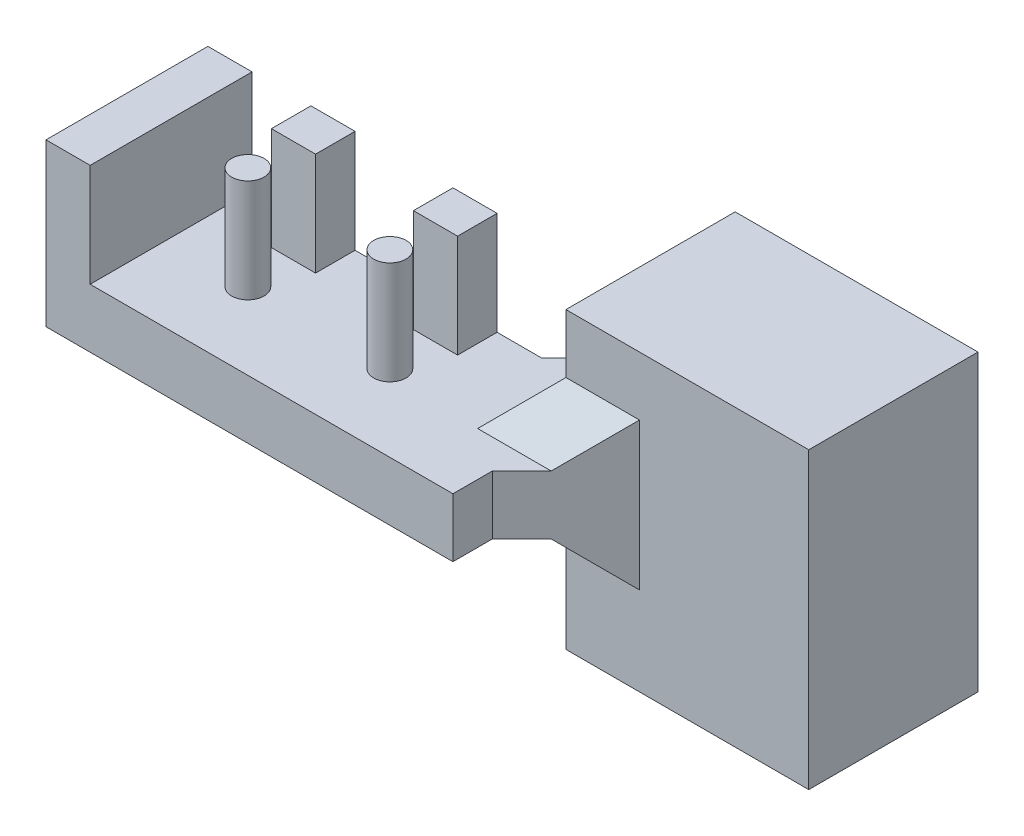
from build123d import *

# Parameters (mm, degrees)
SKETCH1_W           = 16.5
SKETCH1_H           = 11.5
SKETCH1_W_2         = 10.5
SKETCH1_H_2         = 5.5
BOSS_EXTRUDE1_DEPTH = 17
CUT_EXTRUDE1_REACH  = 28.334
SKETCH2_R           = 2.5
SKETCH3_W           = 16.5
SKETCH3_H           = 11.5
BOSS_EXTRUDE2_DEPTH = 3
BOSS_EXTRUDE3_START = -11
SKETCH4_W           = 21.75
SKETCH4_H           = 11
BOSS_EXTRUDE3_DEPTH = 4
CHAMFER1_SIZE       = 5
CHAMFER2_SIZE       = 3
SKETCH5_R           = 1.1
SKETCH5_W           = 3
SKETCH5_H           = 2.684
BOSS_EXTRUDE4_DEPTH = 7
BOSS_EXTRUDE5_DEPTH = 11
CUT_EXTRUDE2_REACH  = 41.144
SKETCH7_W           = 10.5
SKETCH7_H           = 1.5


with BuildPart() as part:
    # Sketch1 → Boss-Extrude1 (new body)
    with BuildSketch(Plane(origin=(0, 0, 0), x_dir=(1, 0, 0), z_dir=(0, 1, 0))):
        with Locations((8.25, 5.75)):
            Rectangle(SKETCH1_W, SKETCH1_H)
        with Locations((8.25, 5.75)):
            Rectangle(SKETCH1_W_2, SKETCH1_H_2, mode=Mode.SUBTRACT)
    extrude(amount=BOSS_EXTRUDE1_DEPTH)

    # Sketch2 → Cut-Extrude1 (cut, up to next)
    with BuildSketch(Plane(origin=(0, 0, -11.5), x_dir=(-1, 0, 0), z_dir=(0, 0, -1)), mode=Mode.PRIVATE) as cut_extrude1_sk1:
        with Locations((-8.25, 10.5)):
            Circle(SKETCH2_R)
    cut_extrude1_tool1 = extrude(cut_extrude1_sk1.sketch, amount=-CUT_EXTRUDE1_REACH, mode=Mode.PRIVATE) & part.part
    add(cut_extrude1_tool1.solids().sort_by_distance((8.25, 10.5, -11.5))[0], mode=Mode.SUBTRACT)

    # Sketch3 → Boss-Extrude2 (add)
    with BuildSketch(Plane(origin=(0, 17, 0), x_dir=(1, 0, 0), z_dir=(0, 1, 0))):
        with Locations((8.25, 5.75)):
            Rectangle(SKETCH3_W, SKETCH3_H)
    extrude(amount=BOSS_EXTRUDE2_DEPTH)

    # Sketch4 → Boss-Extrude3 (add)
    with BuildSketch(Plane(origin=(0, 20, 0), x_dir=(1, 0, 0), z_dir=(0, 1, 0)).offset(BOSS_EXTRUDE3_START)):
        with Locations((-10.875, -2.176)):
            Rectangle(SKETCH4_W, SKETCH4_H)
    extrude(amount=BOSS_EXTRUDE3_DEPTH)

    # Chamfer1
    chamfer1_edges = [part.edges().sort_by_distance(p)[0] for p in [
        (0, 11, 0),
        (0, 11, -3.324),
    ]]
    chamfer(chamfer1_edges, length=CHAMFER1_SIZE)

    # Chamfer2
    chamfer2_edges = [part.edges().sort_by_distance(p)[0] for p in [
        (0, 13, -4.162),
        (0, 9, -4.162),
        (2.5, 13, 0),
        (2.5, 9, 0),
    ]]
    chamfer(chamfer2_edges, length=CHAMFER2_SIZE)

    # Sketch5 → Boss-Extrude4 (add)
    with BuildSketch(Plane(origin=(0, 13, 0), x_dir=(1, 0, 0), z_dir=(0, 1, 0))):
        with Locations(Location((-19.15, -2.46, 0), (0, 0, 270))):
            Circle(SKETCH5_R)
        with Locations(Location((-9.5, -2.46, 0), (0, 0, 270))):
            Circle(SKETCH5_R)
        with Locations((-19.15, 1.982)):
            Rectangle(SKETCH5_W, SKETCH5_H)
        with Locations((-9.5, 1.982)):
            Rectangle(SKETCH5_W, SKETCH5_H)
    extrude(amount=BOSS_EXTRUDE4_DEPTH)

    # Sketch6 → Boss-Extrude5 (add)
    with BuildSketch(Plane.XY.offset(7.676)):
        Polygon((-21.75, 13), (-24.65, 13), (-24.65, 20), (-27.65, 20), (-27.65, 9), (-21.75, 9), align=None)
    extrude(amount=-BOSS_EXTRUDE5_DEPTH)

    # Sketch7 → Cut-Extrude2 (cut, up to next)
    with BuildSketch(Plane(origin=(0, 0, -11.5), x_dir=(-1, 0, 0), z_dir=(0, 0, -1)), mode=Mode.PRIVATE) as cut_extrude2_sk1:
        with Locations((-8.25, 16.25)):
            Rectangle(SKETCH7_W, SKETCH7_H)
    cut_extrude2_tool1 = extrude(cut_extrude2_sk1.sketch, amount=-CUT_EXTRUDE2_REACH, mode=Mode.PRIVATE) & part.part
    add(cut_extrude2_tool1.solids().sort_by_distance((8.25, 16.25, -11.5))[0], mode=Mode.SUBTRACT)


solid = part.part
